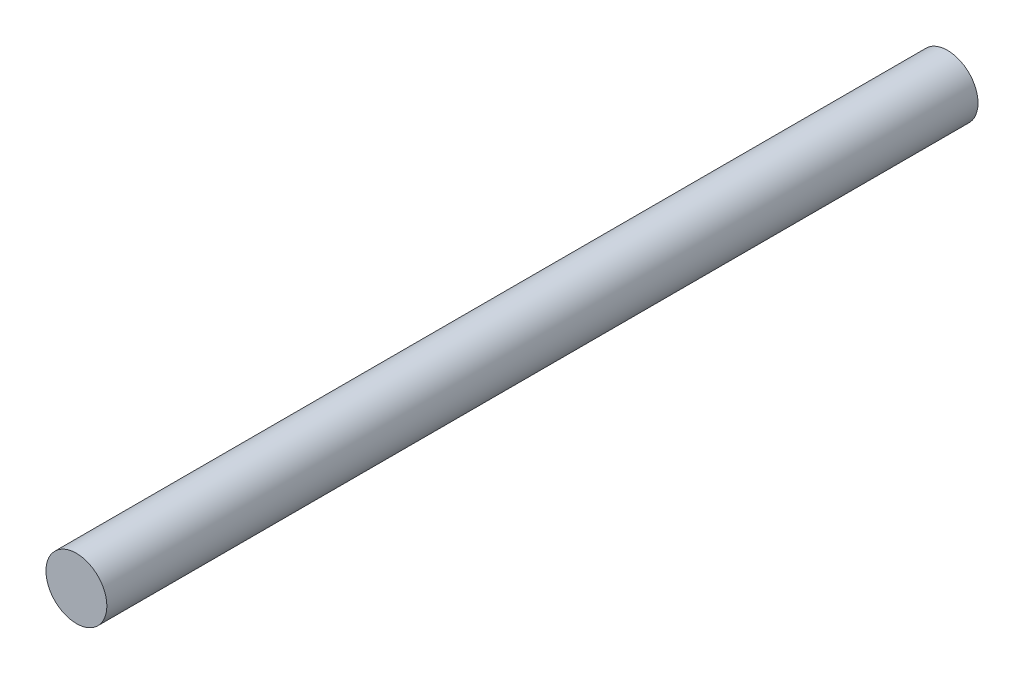
from build123d import *

# Parameters (mm, degrees)
SKETCH1_R           = 4
BOSS_EXTRUDE1_DEPTH = 114.4


with BuildPart() as part:
    # Sketch1 → Boss-Extrude1 (new body)
    with BuildSketch(Plane.XY):
        Circle(SKETCH1_R)
    extrude(amount=BOSS_EXTRUDE1_DEPTH)


solid = part.part
